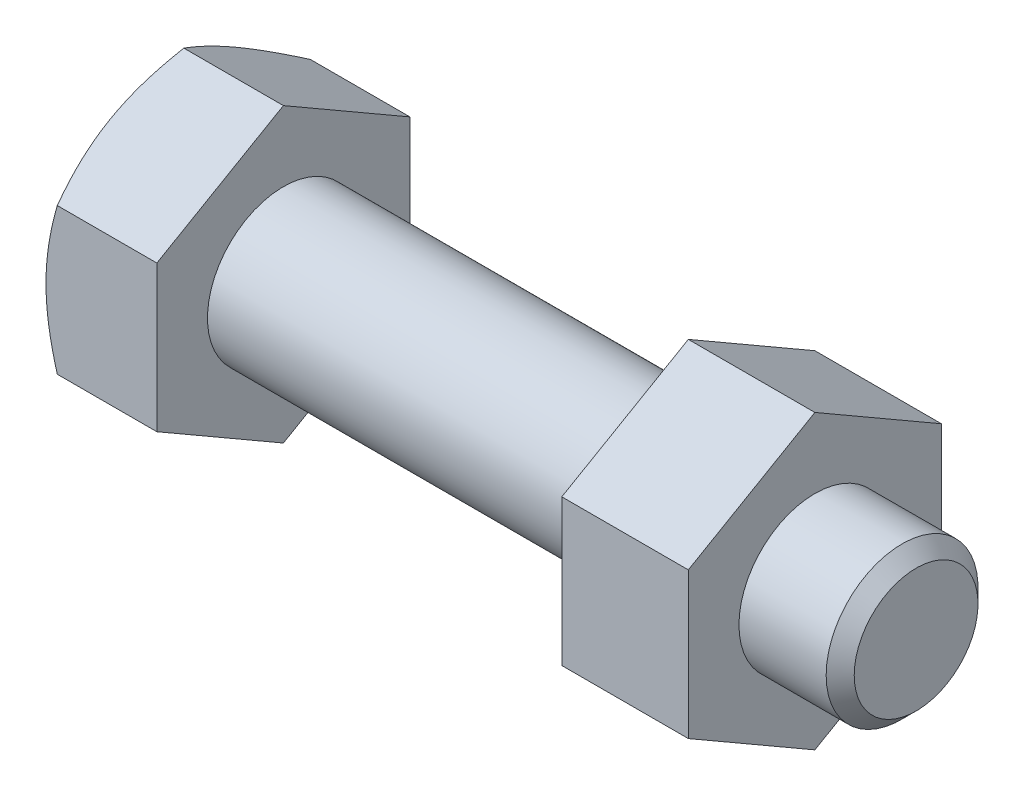
from build123d import *

# Parameters (mm, degrees)
BASEHEAD_DEPTH      = 4.38
BOSS_EXTRUDE1_DEPTH = 5


with BuildPart() as part:
    # Sketch1 → BaseHead (new body)
    with BuildSketch(Plane(origin=(0, 0, 0), x_dir=(0, 0, -1), z_dir=(1, 0, 0))):
        Polygon((5, 2.886751346), (5, -2.886751346), (0, -5.773502692), (-5, -2.886751346), (-5, 2.886751346), (0, 5.773502692), align=None)
    extrude(amount=BASEHEAD_DEPTH)

    # BodySke → BaseBody (revolve)
    with BuildSketch(Plane.XY, mode=Mode.PRIVATE) as basebody_sk:
        Polygon((0, 0), (29.38, 0), (29.38, 2.4455), (28.8255, 3), (0, 3), align=None)
    revolve(basebody_sk.sketch.rotate(Axis((0, 0, 0), (1, 0, 0)), 90), axis=Axis((0, 0, 0), (1, 0, 0)))

    # Sketch3 → HeadChamfer (revolve, cut)
    with BuildSketch(Plane.XY):
        Polygon((0, 5), (3.333333333, 10.773502692), (3.333333333, 15.773502692), (-10, 15.773502692), (-10, 5), align=None)
    revolve(axis=Axis((0, 0, 0), (1, 0, 0)), mode=Mode.SUBTRACT)

    # Sketch4 → Boss-Extrude1 (add)
    with BuildSketch(Plane(origin=(25.38, 0, 0), x_dir=(0, 0, -1), z_dir=(1, 0, 0))):
        Polygon((0, 5.773502692), (-5, 2.886751346), (-5, -2.886751346), (0, -5.773502692), (5, -2.886751346), (5, 2.886751346), align=None)
    extrude(amount=-BOSS_EXTRUDE1_DEPTH)


solid = part.part
